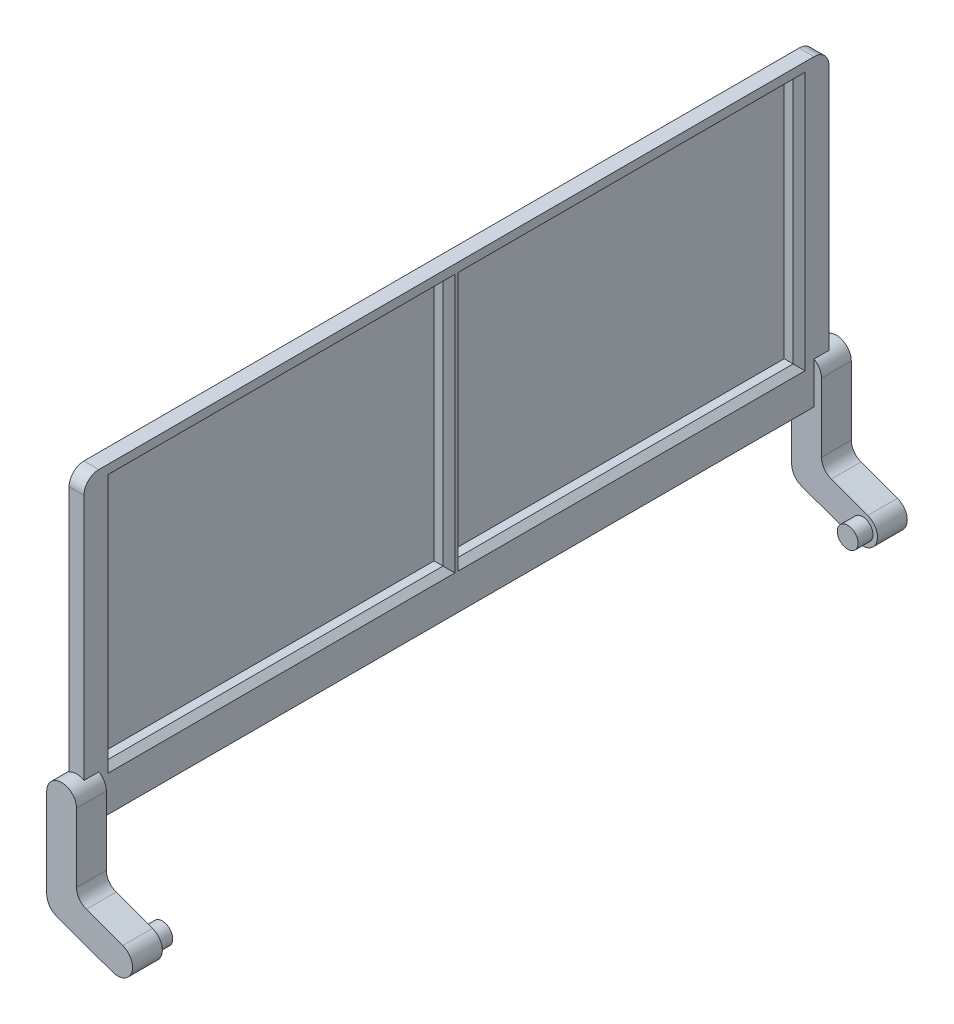
from build123d import *

# Parameters (mm, degrees)
SKETCH2_W           = 112.5
SKETCH2_H           = 82.8
BOSS_EXTRUDE1_DEPTH = 5
CHAMFER1_SIZE       = 2
CUT_EXTRUDE1_DEPTH  = 270.978221344
BOSS_EXTRUDE2_DEPTH = 5
SKETCH5_R           = 3.5
BOSS_EXTRUDE3_DEPTH = 5
SKETCH7_W           = 112.5
SKETCH7_H           = 82.8
BOSS_EXTRUDE5_DEPTH = 1


with BuildPart() as part:
    # Sketch2 → Boss-Extrude1 (new body)
    with BuildSketch(Plane(origin=(0, 0, 0), x_dir=(0, 0, -1), z_dir=(1, 0, 0))):
        with BuildLine():
            Line((-120, 101.8), (120, 101.8))
            ThreePointArc((120, 101.8), (123.535533906, 100.335533906), (125, 96.8))
            Line((125, 96.8), (125, 0))
            Line((125, 0), (-125, 0))
            Line((-125, 0), (-125, 96.8))
            ThreePointArc((-125, 96.8), (-123.535533906, 100.335533906), (-120, 101.8))
        make_face()
        with Locations((58.75, 55.4)):
            Rectangle(SKETCH2_W, SKETCH2_H, mode=Mode.SUBTRACT)
        with Locations((-58.75, 55.4)):
            Rectangle(SKETCH2_W, SKETCH2_H, mode=Mode.SUBTRACT)
    extrude(amount=-BOSS_EXTRUDE1_DEPTH)

    # Chamfer1
    chamfer1_edges = [part.edges().sort_by_distance(p)[0] for p in [
        (0, 96.8, -58.75),
        (0, 55.4, -2.5),
        (0, 14, -58.75),
        (0, 55.4, -115),
        (0, 55.4, 115),
        (0, 14, 58.75),
        (0, 55.4, 2.5),
        (0, 96.8, 58.75),
    ]]
    chamfer(chamfer1_edges, length=CHAMFER1_SIZE)

    # Sketch3 → Cut-Extrude1 (cut, through all)
    with BuildSketch(Plane.XY.offset(125)):
        Polygon((-5, 1.819851171), (-5, 0), (0, 0), align=None)
    extrude(amount=-CUT_EXTRUDE1_DEPTH, mode=Mode.SUBTRACT)



with BuildPart() as body_2:
    # Sketch4 → Boss-Extrude2 (new, symmetric)
    with BuildSketch(Plane.XY.offset(125)):
        with BuildLine():
            Line((-7.5, 9.6), (-7.5, -20.4))
            ThreePointArc((-7.5, -20.4), (-6.595760221, -23.267882182), (-4.210100717, -25.098463104))
            Line((-4.210100717, -25.098463104), (14.583751699, -31.93886597))
            ThreePointArc((14.583751699, -31.93886597), (20.99231552, -28.950503583), (18.003953132, -22.541939763))
            Line((18.003953132, -22.541939763), (5.789899283, -18.096387722))
            ThreePointArc((5.789899283, -18.096387722), (3.404239779, -16.2658068), (2.5, -13.397924618))
            Line((2.5, -13.397924618), (2.5, 9.6))
            ThreePointArc((2.5, 9.6), (-2.5, 14.6), (-7.5, 9.6))
        make_face()
    extrude(amount=BOSS_EXTRUDE2_DEPTH, both=True)

    # Sketch5 → Boss-Extrude3 (add, symmetric)
    with BuildSketch(Plane(origin=(0, 0, 120), x_dir=(-1, 0, 0), z_dir=(0, 0, -1))):
        with Locations((-16.293852416, -27.240402867)):
            Circle(SKETCH5_R)
    extrude(amount=BOSS_EXTRUDE3_DEPTH, both=True)


with BuildPart() as body_3:
    # Mirror1: mirrored copy
    add(body_2.part.mirror(Plane.XY))


with BuildPart() as part_1:
    add(part.part)

    add(body_2.part)  # Boss-Extrude5 merges body 2

    add(body_3.part)  # Boss-Extrude5 merges body 3
    # Sketch7 → Boss-Extrude5 (add)
    with BuildSketch(Plane.ZY.offset(5)):
        with Locations((58.75, 55.4)):
            Rectangle(SKETCH7_W, SKETCH7_H)
        with Locations((-58.75, 55.4)):
            Rectangle(SKETCH7_W, SKETCH7_H)
    extrude(amount=BOSS_EXTRUDE5_DEPTH)


solid = part_1.part
